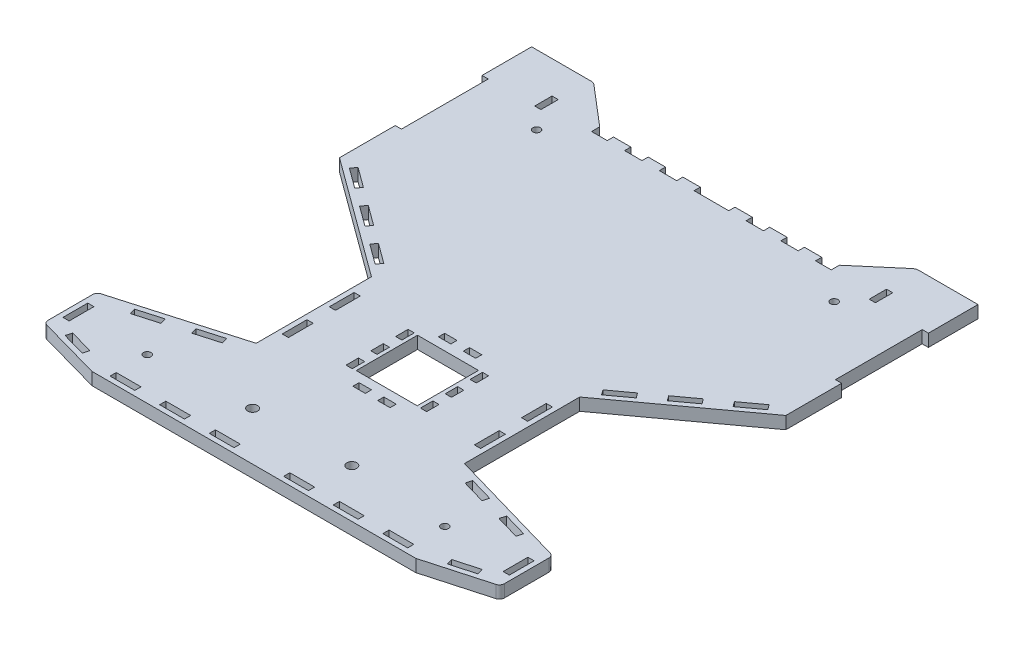
from build123d import *

# Parameters (mm, degrees)
SKETCH1_W           = 2.5
SKETCH1_H           = 10
SKETCH1_W_2         = 10
SKETCH1_H_2         = 2.5
SKETCH1_R           = 1.5
SKETCH1_R_2         = 2
SKETCH1_W_3         = 5
SKETCH1_H_3         = 5
SKETCH1_W_4         = 24.6
SKETCH1_H_4         = 24.7
SKETCH1_H_5         = 7
BOSS_EXTRUDE1_DEPTH = 5
FILLET1_R           = 2


with BuildPart() as part:
    # Sketch1 → Boss-Extrude1 (new body)
    with BuildSketch(Plane(origin=(0, 0, 0), x_dir=(1, 0, 0), z_dir=(0, 1, 0))):
        with BuildLine():
            Line((48.324658201, 85.785074321), (48.324658201, 82.5))
            Line((48.324658201, 82.5), (42, 82.5))
            Line((42, 82.5), (42, 85))
            Line((42, 85), (35, 85))
            Line((35, 85), (35, 82.5))
            Line((35, 82.5), (28, 82.5))
            Line((28, 82.5), (28, 85))
            Line((28, 85), (21, 85))
            Line((21, 85), (21, 82.5))
            Line((21, 82.5), (14, 82.5))
            Line((14, 82.5), (14, 85))
            Line((14, 85), (7, 85))
            Line((7, 85), (7, 82.5))
            Line((7, 82.5), (-7, 82.5))
            Line((-7, 82.5), (-7, 85))
            Line((-7, 85), (-14, 85))
            Line((-14, 85), (-14, 82.5))
            Line((-14, 82.5), (-21, 82.5))
            Line((-21, 82.5), (-21, 85))
            Line((-21, 85), (-28, 85))
            Line((-28, 85), (-28, 82.5))
            Line((-28, 82.5), (-35, 82.5))
            Line((-35, 82.5), (-35, 85))
            Line((-35, 85), (-42, 85))
            Line((-42, 85), (-42, 82.5))
            Line((-42, 82.5), (-48.324658201, 82.5))
            Line((-48.324658201, 82.5), (-48.324658201, 85.785074321))
            Line((-48.324658201, 85.785074321), (-64.158959366, 99.28305337))
            ThreePointArc((-64.158959366, 99.28305337), (-65.068127833, 99.815063064), (-66.105152396, 100))
            Line((-66.105152396, 100), (-90, 100))
            Line((-90, 100), (-90, 80))
            Line((-90, 80), (-87.5, 80))
            Line((-87.5, 80), (-87.5, 45))
            Line((-87.5, 45), (-90, 45))
            Line((-90, 45), (-90, 22.521889972))
            Line((-90, 22.521889972), (-42, -12.595525692))
            Line((-42, -12.595525692), (-42, -59.075909323))
            Line((-42, -59.075909323), (-92, -73.495268006))
            Line((-92, -73.495268006), (-92, -94.516920798))
            Line((-92, -94.516920798), (-65.274717135, -102))
            Line((-65.274717135, -102), (65.274717135, -102))
            Line((65.274717135, -102), (92, -94.516920798))
            Line((92, -94.516920798), (92, -73.495268006))
            Line((92, -73.495268006), (42, -59.075909323))
            Line((42, -59.075909323), (42, -12.595525692))
            Line((42, -12.595525692), (90, 22.521889972))
            Line((90, 22.521889972), (90, 45))
            Line((90, 45), (87.5, 45))
            Line((87.5, 45), (87.5, 80))
            Line((87.5, 80), (90, 80))
            Line((90, 80), (90, 100))
            Line((90, 100), (66.105152396, 100))
            ThreePointArc((66.105152396, 100), (65.068127833, 99.815063064), (64.158959366, 99.28305337))
            Line((64.158959366, 99.28305337), (48.324658201, 85.785074321))
        make_face()
        Polygon((-82.585177048, -92.479999429), (-72.955536851, -95.176298685), (-73.629611665, -97.583708734), (-83.259251862, -94.887409479), align=None, mode=Mode.SUBTRACT)
        with Locations((-88.75, -84)):
            Rectangle(SKETCH1_W, SKETCH1_H, mode=Mode.SUBTRACT)
        with Locations((-55, -98.75)):
            Rectangle(SKETCH1_W_2, SKETCH1_H_2, mode=Mode.SUBTRACT)
        with Locations(Location((-60, -85, 0), (0, 0, 270))):
            Circle(SKETCH1_R, mode=Mode.SUBTRACT)
        Polygon((-78.43370468, -71.664428783), (-68.82527851, -68.893481916), (-68.132541793, -71.295588459), (-77.740967963, -74.066535325), align=None, mode=Mode.SUBTRACT)
        Polygon((-48.915689453, -65.753694725), (-58.524115623, -68.524641592), (-59.21685234, -66.122535049), (-49.60842617, -63.351588183), align=None, mode=Mode.SUBTRACT)
        with Locations((-35, -98.75)):
            Rectangle(SKETCH1_W_2, SKETCH1_H_2, mode=Mode.SUBTRACT)
        with Locations((-15, -98.75)):
            Rectangle(SKETCH1_W_2, SKETCH1_H_2, mode=Mode.SUBTRACT)
        with Locations(Location((-20, -82.5, 0), (0, 0, 270))):
            Circle(SKETCH1_R_2, mode=Mode.SUBTRACT)
        with Locations((-5, -53.330641316)):
            Rectangle(SKETCH1_W_3, SKETCH1_H_2, mode=Mode.SUBTRACT)
        with Locations((-38.75, -45.580641316)):
            Rectangle(SKETCH1_W, SKETCH1_H, mode=Mode.SUBTRACT)
        with Locations((-15, -46.080641316)):
            Rectangle(SKETCH1_W, SKETCH1_H_3, mode=Mode.SUBTRACT)
        with Locations((-15, -36.080641316)):
            Rectangle(SKETCH1_W, SKETCH1_H_3, mode=Mode.SUBTRACT)
        with Locations((-38.75, -26.580641316)):
            Rectangle(SKETCH1_W, SKETCH1_H, mode=Mode.SUBTRACT)
        with Locations((-15, -26.080641316)):
            Rectangle(SKETCH1_W, SKETCH1_H_3, mode=Mode.SUBTRACT)
        with Locations((-5, -18.830641316)):
            Rectangle(SKETCH1_W_3, SKETCH1_H_2, mode=Mode.SUBTRACT)
        with Locations((15, -98.75)):
            Rectangle(SKETCH1_W_2, SKETCH1_H_2, mode=Mode.SUBTRACT)
        with Locations(Location((20, -82.5, 0), (0, 0, 270))):
            Circle(SKETCH1_R_2, mode=Mode.SUBTRACT)
        with Locations((35, -98.75)):
            Rectangle(SKETCH1_W_2, SKETCH1_H_2, mode=Mode.SUBTRACT)
        with Locations((5, -53.330641316)):
            Rectangle(SKETCH1_W_3, SKETCH1_H_2, mode=Mode.SUBTRACT)
        with Locations((55, -98.75)):
            Rectangle(SKETCH1_W_2, SKETCH1_H_2, mode=Mode.SUBTRACT)
        with Locations(Location((60, -85, 0), (0, 0, 270))):
            Circle(SKETCH1_R, mode=Mode.SUBTRACT)
        Polygon((83.259251862, -94.887409479), (73.629611665, -97.583708734), (72.955536851, -95.176298685), (82.585177048, -92.479999429), align=None, mode=Mode.SUBTRACT)
        with Locations((88.75, -84)):
            Rectangle(SKETCH1_W, SKETCH1_H, mode=Mode.SUBTRACT)
        Polygon((48.915689453, -65.753694725), (49.60842617, -63.351588183), (59.21685234, -66.122535049), (58.524115623, -68.524641592), align=None, mode=Mode.SUBTRACT)
        Polygon((68.132541793, -71.295588459), (68.82527851, -68.893481916), (78.43370468, -71.664428783), (77.740967963, -74.066535325), align=None, mode=Mode.SUBTRACT)
        with Locations((15, -46.080641316)):
            Rectangle(SKETCH1_W, SKETCH1_H_3, mode=Mode.SUBTRACT)
        with Locations((0, -36.080641316)):
            Rectangle(SKETCH1_W_4, SKETCH1_H_4, mode=Mode.SUBTRACT)
        with Locations((15, -36.080641316)):
            Rectangle(SKETCH1_W, SKETCH1_H_3, mode=Mode.SUBTRACT)
        with Locations((38.75, -45.580641316)):
            Rectangle(SKETCH1_W, SKETCH1_H, mode=Mode.SUBTRACT)
        with Locations((5, -18.830641316)):
            Rectangle(SKETCH1_W_3, SKETCH1_H_2, mode=Mode.SUBTRACT)
        with Locations((15, -26.080641316)):
            Rectangle(SKETCH1_W, SKETCH1_H_3, mode=Mode.SUBTRACT)
        with Locations((38.75, -26.580641316)):
            Rectangle(SKETCH1_W, SKETCH1_H, mode=Mode.SUBTRACT)
        Polygon((-44.173315854, -5.429752374), (-45.649466667, -7.447419041), (-53.720133334, -1.54281579), (-52.243982521, 0.474850877), align=None, mode=Mode.SUBTRACT)
        Polygon((-59.488515854, 5.775044383), (-60.964666666, 3.757377717), (-69.035333334, 9.661980967), (-67.559182521, 11.679647634), align=None, mode=Mode.SUBTRACT)
        Polygon((-74.803715853, 16.979841141), (-76.279866666, 14.962174474), (-84.350533333, 20.866777725), (-82.87438252, 22.884444391), align=None, mode=Mode.SUBTRACT)
        with Locations(Location((-60, 72, 0), (0, 0, 270))):
            Circle(SKETCH1_R, mode=Mode.SUBTRACT)
        with Locations((-67.45, 83.43)):
            Rectangle(SKETCH1_W, SKETCH1_H_5, mode=Mode.SUBTRACT)
        Polygon((44.173315854, -5.429752374), (52.243982521, 0.474850877), (53.720133334, -1.54281579), (45.649466667, -7.447419041), align=None, mode=Mode.SUBTRACT)
        Polygon((59.488515854, 5.775044383), (67.559182521, 11.679647634), (69.035333334, 9.661980967), (60.964666666, 3.757377717), align=None, mode=Mode.SUBTRACT)
        Polygon((74.803715853, 16.979841141), (82.87438252, 22.884444391), (84.350533333, 20.866777725), (76.279866666, 14.962174474), align=None, mode=Mode.SUBTRACT)
        with Locations(Location((60, 72, 0), (0, 0, 270))):
            Circle(SKETCH1_R, mode=Mode.SUBTRACT)
        with Locations((67.45, 83.43)):
            Rectangle(SKETCH1_W, SKETCH1_H_5, mode=Mode.SUBTRACT)
    extrude(amount=BOSS_EXTRUDE1_DEPTH)

    # Fillet1
    fillet1_edges = [part.edges().sort_by_distance(p)[0] for p in [
        (92, 2.5, 73.495268006),
        (92, 2.5, 94.516920798),
        (-92, 2.5, 94.516920798),
        (-92, 2.5, 73.495268006),
    ]]
    fillet(fillet1_edges, radius=FILLET1_R)


solid = part.part
